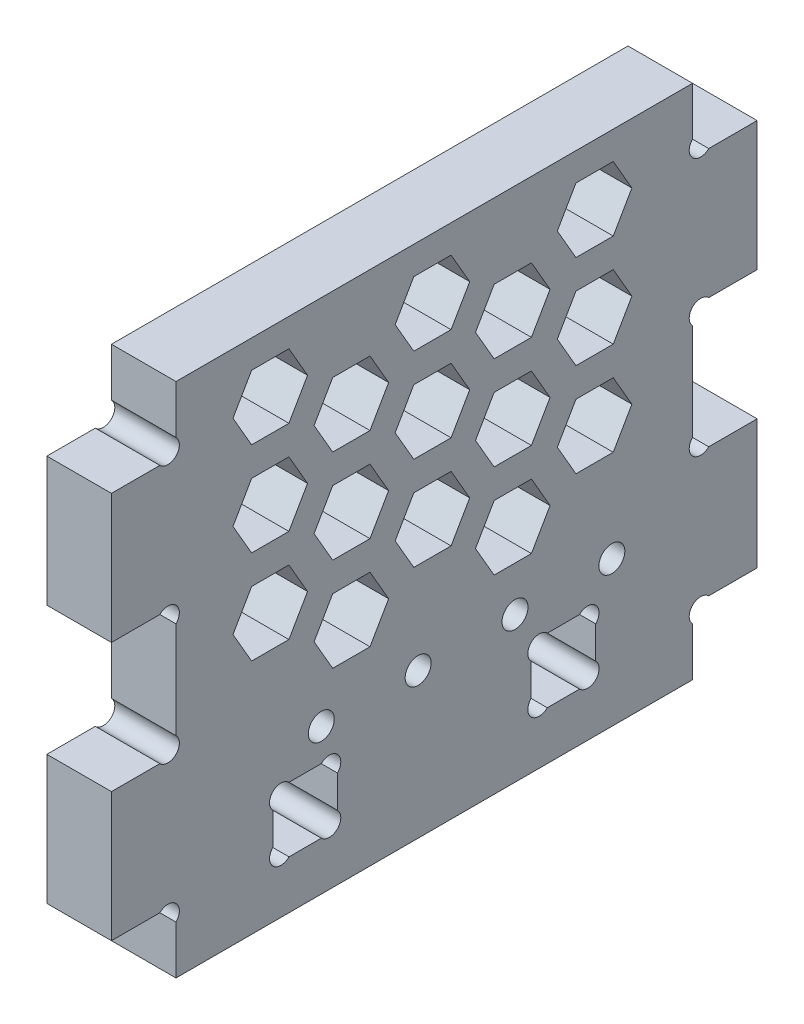
from build123d import *

# Parameters (mm, degrees)
SKETCH3_W                 = 101.6
SKETCH3_H                 = 101.6
SQUARE_EXTRUSION_DEPTH    = 12.7
SKETCH4_R                 = 2.24536
SKETCH4_W                 = 12.7
SKETCH4_H                 = 12.7
SLOTTING_HOLES_DEPTH      = 12.7
HONEYCOMB_POCKETING_DEPTH = 12.7
SIDE_SLOTS_DEPTH          = 12.7
SKETCH12_R                = 2.5527
SKETCH12_R_2              = 2.24535998
CUT_EXTRUDE1_DEPTH        = 83.30540687


with BuildPart() as part:
    # Sketch3 → Square Extrusion (new body)
    with BuildSketch(Plane(origin=(0, 0, 0), x_dir=(0, 0, -1), z_dir=(1, 0, 0))):
        Rectangle(SKETCH3_W, SKETCH3_H)
    extrude(amount=SQUARE_EXTRUSION_DEPTH)

    # Sketch4 → Slotting Holes (cut)
    with BuildSketch(Plane(origin=(12.7, 0, 0), x_dir=(0, 0, -1), z_dir=(1, 0, 0))):
        with BuildLine():
            ThreePointArc((-28.574581463, -28.575), (-31.750209282, -28.574790718), (-31.75, -31.750418537))
            Line((-31.75, -31.750418537), (-31.75, -28.575))
            Line((-31.75, -28.575), (-28.574581463, -28.575))
        make_face()
        with BuildLine():
            Line((-31.75, -28.575), (-31.75, -31.750418537))
            ThreePointArc((-31.75, -31.750418537), (-29.303101219, -32.236885515), (-27.91714, -30.1625))
            ThreePointArc((-27.91714, -30.1625), (-28.08800123, -29.303374641), (-28.574581463, -28.575))
            Line((-28.574581463, -28.575), (-31.75, -28.575))
        make_face()
        with Locations((-30.1625, -39.6875)):
            Circle(SKETCH4_R)
        with Locations((-20.6375, -39.6875)):
            Circle(SKETCH4_R)
        with Locations((-20.6375, -30.1625)):
            Circle(SKETCH4_R)
        with Locations((-30.1625, -30.1625)):
            Circle(SKETCH4_R)
        with Locations((-25.4, -34.925)):
            Rectangle(SKETCH4_W, SKETCH4_H)
        with BuildLine():
            ThreePointArc((-22.225418537, -28.575), (-22.225209282, -31.750209282), (-19.05, -31.750418537))
            Line((-19.05, -31.750418537), (-19.05, -28.575))
            Line((-19.05, -28.575), (-22.225418537, -28.575))
        make_face()
        with BuildLine():
            Line((-19.05, -28.575), (-19.05, -31.750418537))
            ThreePointArc((-19.05, -31.750418537), (-18.563114485, -31.021898781), (-18.39214, -30.1625))
            ThreePointArc((-18.39214, -30.1625), (-19.778374641, -28.08800123), (-22.225418537, -28.575))
            Line((-22.225418537, -28.575), (-19.05, -28.575))
        make_face()
        with BuildLine():
            Line((-31.75, -38.099581463), (-31.75, -41.275))
            Line((-31.75, -41.275), (-28.574581463, -41.275))
            ThreePointArc((-28.574581463, -41.275), (-28.08800123, -40.546625359), (-27.91714, -39.6875))
            ThreePointArc((-27.91714, -39.6875), (-29.303101219, -37.613114485), (-31.75, -38.099581463))
        make_face()
        with BuildLine():
            Line((-28.574581463, -41.275), (-31.75, -41.275))
            Line((-31.75, -41.275), (-31.75, -38.099581463))
            ThreePointArc((-31.75, -38.099581463), (-31.750209282, -41.275209282), (-28.574581463, -41.275))
        make_face()
        with BuildLine():
            ThreePointArc((-19.05, -38.099581463), (-22.225209282, -38.099790718), (-22.225418537, -41.275))
            Line((-22.225418537, -41.275), (-19.05, -41.275))
            Line((-19.05, -41.275), (-19.05, -38.099581463))
        make_face()
        with BuildLine():
            Line((-19.05, -41.275), (-22.225418537, -41.275))
            ThreePointArc((-22.225418537, -41.275), (-19.778374641, -41.76199877), (-18.39214, -39.6875))
            ThreePointArc((-18.39214, -39.6875), (-18.563114485, -38.828101219), (-19.05, -38.099581463))
            Line((-19.05, -38.099581463), (-19.05, -41.275))
        make_face()
        with BuildLine():
            ThreePointArc((22.88286, -30.1625), (22.71199877, -29.303374641), (22.225418537, -28.575))
            Line((22.225418537, -28.575), (19.05, -28.575))
            Line((19.05, -28.575), (19.05, -31.750418537))
            ThreePointArc((19.05, -31.750418537), (21.496898781, -32.236885515), (22.88286, -30.1625))
        make_face()
        with BuildLine():
            Line((19.05, -28.575), (22.225418537, -28.575))
            ThreePointArc((22.225418537, -28.575), (19.049790718, -28.574790718), (19.05, -31.750418537))
            Line((19.05, -31.750418537), (19.05, -28.575))
        make_face()
        with Locations((30.1625, -30.1625)):
            Circle(SKETCH4_R)
        with Locations((20.6375, -30.1625)):
            Circle(SKETCH4_R)
        with Locations((20.6375, -39.6875)):
            Circle(SKETCH4_R)
        with Locations((30.1625, -39.6875)):
            Circle(SKETCH4_R)
        with Locations((25.4, -34.925)):
            Rectangle(SKETCH4_W, SKETCH4_H)
        with BuildLine():
            Line((31.75, -31.750418537), (31.75, -28.575))
            Line((31.75, -28.575), (28.574581463, -28.575))
            ThreePointArc((28.574581463, -28.575), (28.574790718, -31.750209282), (31.75, -31.750418537))
        make_face()
        with BuildLine():
            Line((28.574581463, -28.575), (31.75, -28.575))
            Line((31.75, -28.575), (31.75, -31.750418537))
            ThreePointArc((31.75, -31.750418537), (32.236885515, -31.021898781), (32.40786, -30.1625))
            ThreePointArc((32.40786, -30.1625), (31.021625359, -28.08800123), (28.574581463, -28.575))
        make_face()
        with BuildLine():
            ThreePointArc((32.40786, -39.6875), (32.236885515, -38.828101219), (31.75, -38.099581463))
            Line((31.75, -38.099581463), (31.75, -41.275))
            Line((31.75, -41.275), (28.574581463, -41.275))
            ThreePointArc((28.574581463, -41.275), (31.021625359, -41.76199877), (32.40786, -39.6875))
        make_face()
        with BuildLine():
            Line((31.75, -41.275), (31.75, -38.099581463))
            ThreePointArc((31.75, -38.099581463), (28.574790718, -38.099790718), (28.574581463, -41.275))
            Line((28.574581463, -41.275), (31.75, -41.275))
        make_face()
        with BuildLine():
            ThreePointArc((22.88286, -39.6875), (21.496898781, -37.613114485), (19.05, -38.099581463))
            Line((19.05, -38.099581463), (19.05, -41.275))
            Line((19.05, -41.275), (22.225418537, -41.275))
            ThreePointArc((22.225418537, -41.275), (22.71199877, -40.546625359), (22.88286, -39.6875))
        make_face()
        with BuildLine():
            Line((19.05, -41.275), (19.05, -38.099581463))
            ThreePointArc((19.05, -38.099581463), (19.049790718, -41.275209282), (22.225418537, -41.275))
            Line((22.225418537, -41.275), (19.05, -41.275))
        make_face()
    extrude(amount=-SLOTTING_HOLES_DEPTH, mode=Mode.SUBTRACT)

    # Sketch9 → Honeycomb Pocketing (cut)
    with BuildSketch(Plane(origin=(12.7, 0, 0), x_dir=(0, 0, -1), z_dir=(1, 0, 0))):
        Polygon((-35.926583558, 32.58118298), (-28.594235139, 32.581185003), (-24.928062682, 38.931186014), (-28.594238643, 45.281185003), (-35.926587062, 45.28118298), (-39.592759519, 38.931181968), align=None)
        Polygon((-4.030867936, 32.58118298), (3.301480483, 32.581185003), (6.96765294, 38.931186014), (3.301476978, 45.281185003), (-4.03087144, 45.28118298), (-7.697043898, 38.931181968), align=None)
        Polygon((27.864847685, 32.58118298), (35.197196104, 32.581185003), (38.863368561, 38.931186014), (35.1971926, 45.281185003), (27.864844181, 45.28118298), (24.198671724, 38.931181968), align=None)
        Polygon((-19.978725747, 23.37368298), (-12.646377328, 23.373685003), (-8.980204871, 29.723686014), (-12.646380832, 36.073685003), (-19.978729251, 36.07368298), (-23.644901708, 29.723681968), align=None)
        Polygon((11.771274253, 23.37368298), (19.103622672, 23.373685003), (22.769795129, 29.723686014), (19.103619168, 36.073685003), (11.771270749, 36.07368298), (8.105098292, 29.723681968), align=None)
        Polygon((27.864847685, 14.16618298), (35.197196104, 14.166185003), (38.863368561, 20.516186014), (35.1971926, 26.866185003), (27.864844181, 26.86618298), (24.198671724, 20.516181968), align=None)
        Polygon((-4.030867936, 14.16618298), (3.301480483, 14.166185003), (6.96765294, 20.516186014), (3.301476978, 26.866185003), (-4.03087144, 26.86618298), (-7.697043898, 20.516181968), align=None)
        Polygon((-35.926583558, 14.16618298), (-28.594235139, 14.166185003), (-24.928062682, 20.516186014), (-28.594238643, 26.866185003), (-35.926587062, 26.86618298), (-39.592759519, 20.516181968), align=None)
        Polygon((-19.978725747, 4.95868298), (-12.646377328, 4.958685003), (-8.980204871, 11.308686014), (-12.646380832, 17.658685003), (-19.978729251, 17.65868298), (-23.644901708, 11.308681968), align=None)
        Polygon((11.771274253, 4.95868298), (19.103622672, 4.958685003), (22.769795129, 11.308686014), (19.103619168, 17.658685003), (11.771270749, 17.65868298), (8.105098292, 11.308681968), align=None)
        Polygon((-35.926583558, -4.24881702), (-28.594235139, -4.248814997), (-24.928062682, 2.101186014), (-28.594238643, 8.451185003), (-35.926587062, 8.45118298), (-39.592759519, 2.101181968), align=None)
        Polygon((-4.030867936, -4.24881702), (3.301480483, -4.248814997), (6.96765294, 2.101186014), (3.301476978, 8.451185003), (-4.03087144, 8.45118298), (-7.697043898, 2.101181968), align=None)
        Polygon((27.864847685, -4.24881702), (35.197196104, -4.248814997), (38.863368561, 2.101186014), (35.1971926, 8.451185003), (27.864844181, 8.45118298), (24.198671724, 2.101181968), align=None)
        Polygon((-19.978725747, -13.45631702), (-12.646377328, -13.456314997), (-8.980204871, -7.106313986), (-12.646380832, -0.756314997), (-19.978729251, -0.75631702), (-23.644901708, -7.106318032), align=None)
        Polygon((11.771274253, -13.45631702), (19.103622672, -13.456314997), (22.769795129, -7.106313986), (19.103619168, -0.756314997), (11.771270749, -0.75631702), (8.105098292, -7.106318032), align=None)
    extrude(amount=-HONEYCOMB_POCKETING_DEPTH, mode=Mode.SUBTRACT)

    # Sketch10 → Side Slots (add)
    with BuildSketch(Plane(origin=(12.7, 0, 0), x_dir=(0, 0, -1), z_dir=(1, 0, 0))):
        with BuildLine():
            Line((-50.8, 12.7), (-50.8, 38.1))
            ThreePointArc((-50.8, 38.1), (-52.387709268, 37.442349288), (-53.975418537, 38.1))
            Line((-53.975418537, 38.1), (-63.5, 38.1))
            Line((-63.5, 38.1), (-63.5, 12.7))
            Line((-63.5, 12.7), (-53.975418537, 12.7))
            ThreePointArc((-53.975418537, 12.7), (-52.387709268, 13.357650712), (-50.8, 12.7))
        make_face()
        with BuildLine():
            Line((-53.975418537, -12.7), (-63.5, -12.7))
            Line((-63.5, -12.7), (-63.5, -38.1))
            Line((-63.5, -38.1), (-53.975418537, -38.1))
            ThreePointArc((-53.975418537, -38.1), (-52.387709268, -37.442349288), (-50.8, -38.1))
            Line((-50.8, -38.1), (-50.8, -12.7))
            ThreePointArc((-50.8, -12.7), (-52.387709268, -13.357650712), (-53.975418537, -12.7))
        make_face()
        with BuildLine():
            ThreePointArc((50.8, -38.1), (52.387709268, -37.442349288), (53.975418537, -38.1))
            Line((53.975418537, -38.1), (63.5, -38.1))
            Line((63.5, -38.1), (63.5, -12.7))
            Line((63.5, -12.7), (53.975418537, -12.7))
            ThreePointArc((53.975418537, -12.7), (52.387709268, -13.357650712), (50.8, -12.7))
            Line((50.8, -12.7), (50.8, -38.1))
        make_face()
        with BuildLine():
            Line((53.975418537, 12.7), (63.5, 12.7))
            Line((63.5, 12.7), (63.5, 38.1))
            Line((63.5, 38.1), (53.975418537, 38.1))
            ThreePointArc((53.975418537, 38.1), (52.387709268, 37.442349288), (50.8, 38.1))
            Line((50.8, 38.1), (50.8, 12.7))
            ThreePointArc((50.8, 12.7), (52.387709268, 13.357650712), (53.975418537, 12.7))
        make_face()
    extrude(amount=-SIDE_SLOTS_DEPTH)

    # Sketch12 → Cut-Extrude1 (cut, through all)
    with BuildSketch(Plane(origin=(12.7, 0, 0), x_dir=(0, 0, -1), z_dir=(1, 0, 0))):
        with Locations((-22.225, -22.225)):
            Circle(SKETCH12_R)
        with Locations((-3.175, -22.225)):
            Circle(SKETCH12_R)
        with Locations((15.875, -22.225)):
            Circle(SKETCH12_R)
        with Locations((34.925, -22.225)):
            Circle(SKETCH12_R)
        with Locations((-52.387709268, 39.687709268)):
            Circle(SKETCH12_R_2)
        with Locations((-52.387709268, 11.112290732)):
            Circle(SKETCH12_R_2)
        with Locations((-52.387709268, -11.112290732)):
            Circle(SKETCH12_R_2)
        with Locations((-52.387709268, -39.687709268)):
            Circle(SKETCH12_R_2)
        with Locations((52.387709268, 39.687709268)):
            Circle(SKETCH12_R_2)
        with Locations((52.387709268, 11.112290732)):
            Circle(SKETCH12_R_2)
        with Locations((52.387709268, -11.112290732)):
            Circle(SKETCH12_R_2)
        with Locations((52.387709268, -39.687709268)):
            Circle(SKETCH12_R_2)
    extrude(amount=-CUT_EXTRUDE1_DEPTH, mode=Mode.SUBTRACT)


solid = part.part
